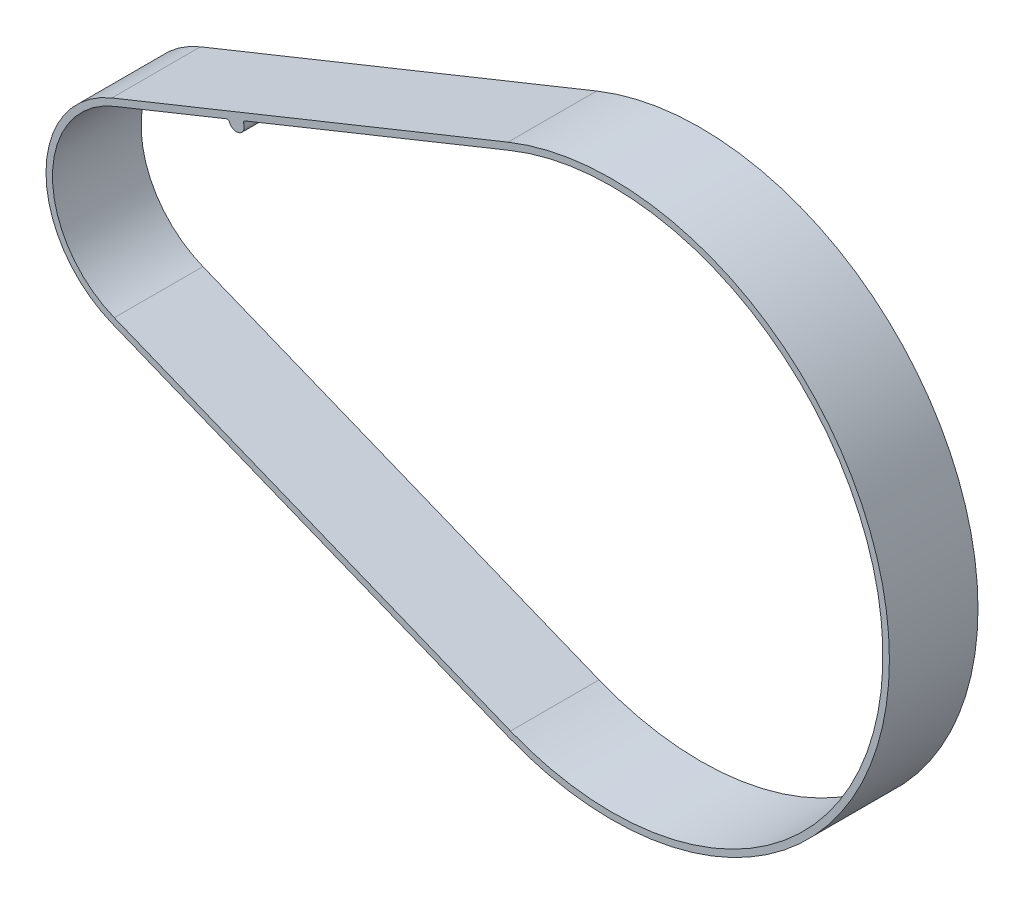
from build123d import *

# Parameters (mm, degrees)
BOSS_EXTRUDE1_DEPTH = 15
BOSS_EXTRUDE2_DEPTH = 15
FILLET4_R           = 0.8


with BuildPart() as part:
    # Sketch1 → Boss-Extrude1 (new, symmetric)
    with BuildSketch(Plane.XY):
        with BuildLine():
            Line((-13.329010746, 33.041463317), (120.837574837, 87.164606832))
            ThreePointArc((120.837574837, 87.164606832), (249.989705965, 0), (120.837574837, -87.164606832))
            Line((120.837574837, -87.164606832), (-13.329010746, -33.041463317))
            ThreePointArc((-13.329010746, -33.041463317), (-35.628651751, 0), (-13.329010746, 33.041463317))
        make_face()
        with BuildLine():
            Line((-12.505970238, 31.001217174), (121.660615345, 85.124360689))
            ThreePointArc((121.660615345, 85.124360689), (247.789705965, 0), (121.660615345, -85.124360689))
            Line((121.660615345, -85.124360689), (-12.505970238, -31.001217174))
            ThreePointArc((-12.505970238, -31.001217174), (-33.428651751, 0), (-12.505970238, 31.001217174))
        make_face(mode=Mode.SUBTRACT)
    extrude(amount=BOSS_EXTRUDE1_DEPTH, both=True)

    # Sketch2 → Boss-Extrude2 (add, symmetric)
    with BuildSketch(Plane.XY):
        with BuildLine():
            Line((26.425162942, 46.022572764), (26.179278266, 46.606945289))
            Line((26.179278266, 46.606945289), (30.962929341, 48.536682358))
            Line((30.962929341, 48.536682358), (31.237715226, 47.963968655))
            ThreePointArc((31.237715226, 47.963968655), (29.866253214, 44.428056099), (26.425162942, 46.022572764))
        make_face()
    extrude(amount=BOSS_EXTRUDE2_DEPTH, both=True)

    # Fillet4
    fillet4_edges = [part.edges().sort_by_distance(p)[0] for p in [
        (30.962929341, 48.536682358, 0),
        (26.179278266, 46.606945289, 0),
    ]]
    fillet(fillet4_edges, radius=FILLET4_R)


solid = part.part
